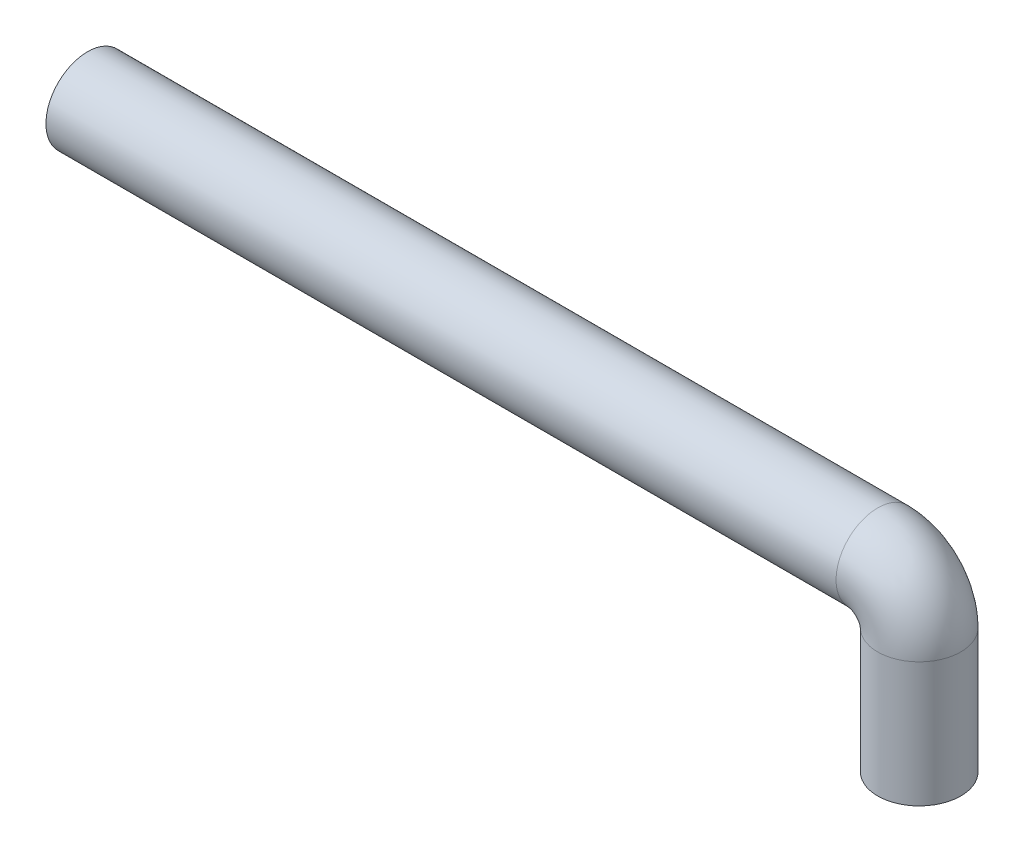
from build123d import *

# Parameters (mm, degrees)
SKETCH3_R = 1.5875


with BuildPart() as part:
    # Sweep1: sweep along a path in Sketch2
    with BuildLine(Plane.XY) as sweep1_path:
        Line((0, 0), (30.1625, 0))
        ThreePointArc((30.1625, 0), (31.285032015, -0.464967985), (31.75, -1.5875))
        Line((31.75, -1.5875), (31.75, -6.35))
    # Sketch3 → Sweep1 (sweep)
    with BuildSketch(Plane(origin=(0, 0, 0), x_dir=(0, 0, -1), z_dir=(1, 0, 0))):
        Circle(SKETCH3_R)
    sweep(path=sweep1_path.line)


solid = part.part
